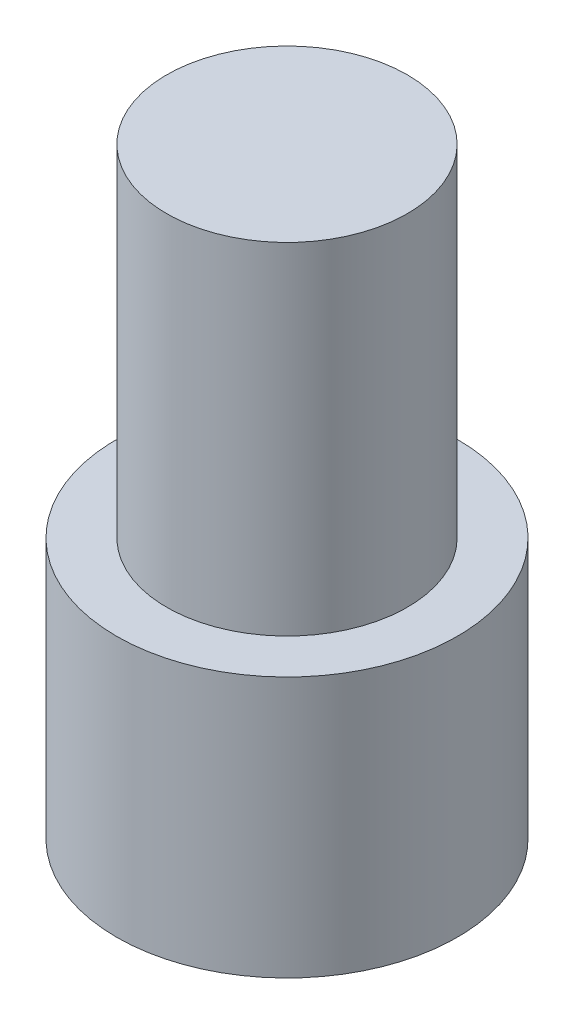
from build123d import *


with BuildPart() as part:
    # Sketch1 → Revolve1 (revolve)
    with BuildSketch(Plane.XY):
        Polygon((0, 0), (0.6, 0), (0.6, -1.7), (0.85, -1.7), (0.85, -3), (0, -3), align=None)
    revolve(axis=Axis((0, 0, 0), (0, 1, 0)))


solid = part.part
